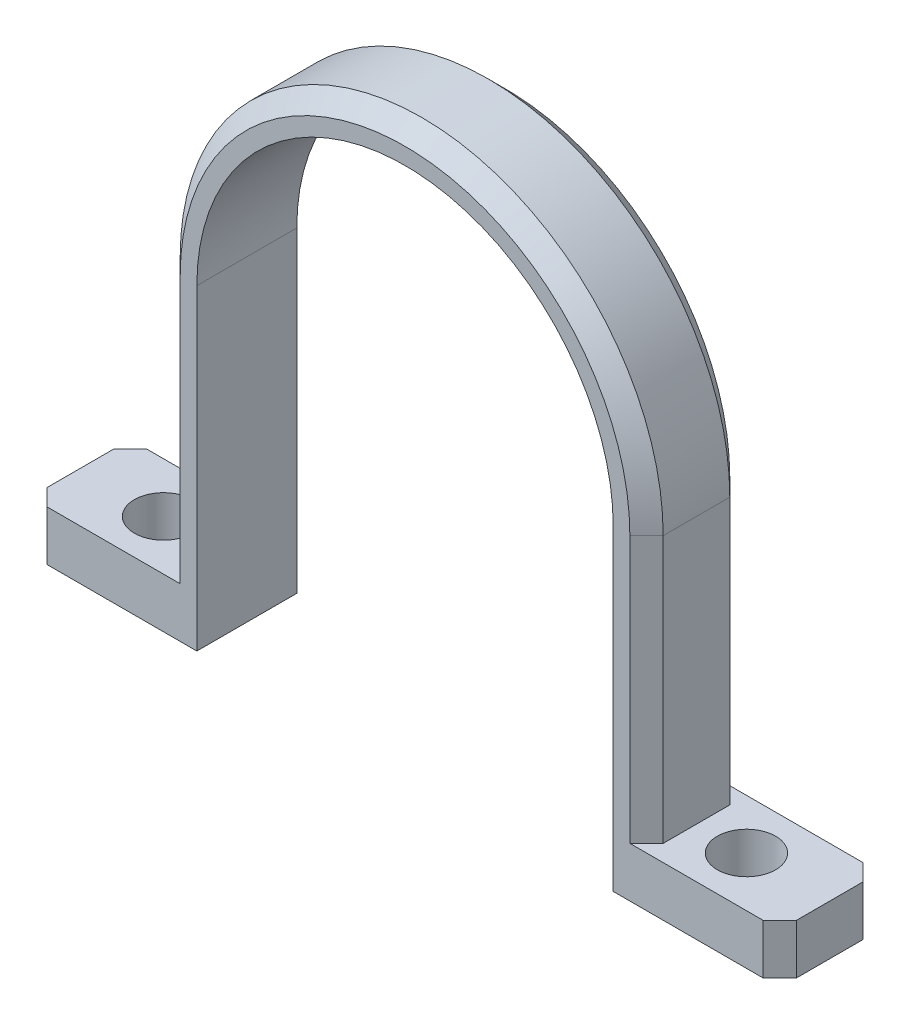
from build123d import *

# Parameters (mm, degrees)
BOSS_EXTRUDE1_DEPTH = 6
SKETCH2_R           = 1.75
CUT_EXTRUDE1_DEPTH  = 41.798284278
CHAMFER1_SIZE       = 1


with BuildPart() as part:
    # Sketch1 → Boss-Extrude1 (new body)
    with BuildSketch(Plane.XY):
        with BuildLine():
            Line((-14.5, 0), (-14.5, -16))
            Line((-14.5, -16), (-22.5, -16))
            Line((-22.5, -16), (-22.5, -19))
            Line((-22.5, -19), (-12.5, -19))
            Line((-12.5, -19), (-12.5, 0))
            ThreePointArc((-12.5, 0), (0, 12.5), (12.5, 0))
            Line((12.5, 0), (12.5, -19))
            Line((12.5, -19), (22.5, -19))
            Line((22.5, -19), (22.5, -16))
            Line((22.5, -16), (14.5, -16))
            Line((14.5, -16), (14.5, 0))
            ThreePointArc((14.5, 0), (0, 14.5), (-14.5, 0))
        make_face()
    extrude(amount=BOSS_EXTRUDE1_DEPTH)

    # Sketch2 → Cut-Extrude1 (cut, through all)
    with BuildSketch(Plane.XZ.offset(19)):
        with Locations((-17.5, 3)):
            Circle(SKETCH2_R)
        with Locations((17.5, 3)):
            Circle(SKETCH2_R)
    extrude(amount=-CUT_EXTRUDE1_DEPTH, mode=Mode.SUBTRACT)

    # Chamfer1
    chamfer1_edges = [part.edges().sort_by_distance(p)[0] for p in [
        (14.5, -8, 0),
        (22.5, -17.5, 0),
        (-22.5, -17.5, 0),
        (-14.5, -8, 0),
        (0, 14.5, 0),
        (-22.5, -17.5, 6),
        (22.5, -17.5, 6),
        (14.5, -8, 6),
        (0, 14.5, 6),
        (-14.5, -8, 6),
    ]]
    chamfer(chamfer1_edges, length=CHAMFER1_SIZE)


solid = part.part
